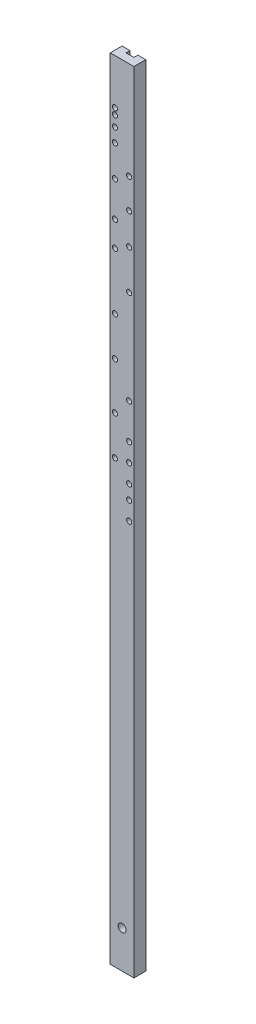
from build123d import *

# Parameters (mm, degrees)
SKETCH1_W           = 19.05
SKETCH1_H           = 1270
BOSS_EXTRUDE1_DEPTH = 19.05
SKETCH2_R           = 6.35
CUT_EXTRUDE1_DEPTH  = 636.571243056
SKETCH4_W           = 12.7
SKETCH4_H           = 12.7
CUT_EXTRUDE2_DEPTH  = 1271.178581194
SKETCH5_R           = 1.905
CUT_EXTRUDE3_DEPTH  = 636.571243056
SKETCH6_R           = 4.1275
CUT_EXTRUDE4_DEPTH  = 7.747


with BuildPart() as part:
    # Sketch1 → Boss-Extrude1 (new, symmetric)
    with BuildSketch(Plane(origin=(0, 0, 0), x_dir=(0, 0, -1), z_dir=(1, 0, 0))):
        Rectangle(SKETCH1_W, SKETCH1_H)
    extrude(amount=BOSS_EXTRUDE1_DEPTH, both=True)

    # Sketch2 → Cut-Extrude1 (cut, through all)
    with BuildSketch(Plane.XY.offset(9.525)):
        with Locations((0, -574.675)):
            Circle(SKETCH2_R)
    extrude(amount=-CUT_EXTRUDE1_DEPTH, mode=Mode.SUBTRACT)

    # Sketch4 → Cut-Extrude2 (cut, through all)
    with BuildSketch(Plane(origin=(0, 635, 0), x_dir=(1, 0, 0), z_dir=(0, 1, 0))):
        with Locations((0, 9.525)):
            Rectangle(SKETCH4_W, SKETCH4_H)
    extrude(amount=-CUT_EXTRUDE2_DEPTH, mode=Mode.SUBTRACT)

    # Sketch5 → Cut-Extrude3 (cut, through all)
    with BuildSketch(Plane.XY.offset(9.525)):
        with Locations((-11.43, 513.302135886)):
            Circle(SKETCH5_R)
        with Locations((11.43, 478.263647874)):
            Circle(SKETCH5_R)
        with Locations((-11.43, 463.345550332)):
            Circle(SKETCH5_R)
        with Locations((11.43, 430.113859098)):
            Circle(SKETCH5_R)
        with Locations((-11.43, 407.064148942)):
            Circle(SKETCH5_R)
        with Locations((11.43, 379.842698104)):
            Circle(SKETCH5_R)
        with Locations((-11.43, 366.551491472)):
            Circle(SKETCH5_R)
        with Locations((11.43, 316.418969048)):
            Circle(SKETCH5_R)
        with Locations((-11.43, 535.422112699)):
            Circle(SKETCH5_R)
        with Locations((-11.43, 552.28498253)):
            Circle(SKETCH5_R)
        with Locations((-11.43, 562.430692594)):
            Circle(SKETCH5_R)
        with Locations((11.43, 165.149796436)):
            Circle(SKETCH5_R)
        with Locations((11.43, 108.45633512)):
            Circle(SKETCH5_R)
        with Locations((11.43, 79.058526758)):
            Circle(SKETCH5_R)
        with Locations((11.43, 49.653866377)):
            Circle(SKETCH5_R)
        with Locations((11.43, 27.043187605)):
            Circle(SKETCH5_R)
        with Locations((11.43, -2.198894726)):
            Circle(SKETCH5_R)
        with Locations((-11.43, 74.386924519)):
            Circle(SKETCH5_R)
        with Locations((-11.43, 137.013245544)):
            Circle(SKETCH5_R)
        with Locations((-11.43, 212.596714918)):
            Circle(SKETCH5_R)
        with Locations((-11.43, 275.179690854)):
            Circle(SKETCH5_R)
    extrude(amount=-CUT_EXTRUDE3_DEPTH, mode=Mode.SUBTRACT)

    # Sketch6 → Cut-Extrude4 (cut)
    with BuildSketch(Plane.XY.offset(9.525)):
        with Locations((-11.43, 513.302135886)):
            Circle(SKETCH6_R)
        with Locations((11.43, 478.263647874)):
            Circle(SKETCH6_R)
        with Locations((-11.43, 463.345550332)):
            Circle(SKETCH6_R)
        with Locations((11.43, 430.113859098)):
            Circle(SKETCH6_R)
        with Locations((11.43, 379.842698104)):
            Circle(SKETCH6_R)
        with Locations((11.43, 316.418969048)):
            Circle(SKETCH6_R)
        with Locations((-11.43, 366.551491472)):
            Circle(SKETCH6_R)
        with Locations((-11.43, 407.064148942)):
            Circle(SKETCH6_R)
        with Locations((-11.43, 562.430692594)):
            Circle(SKETCH6_R)
        with Locations((-11.43, 552.28498253)):
            Circle(SKETCH6_R)
        with Locations((-11.43, 535.422112699)):
            Circle(SKETCH6_R)
        with Locations((-11.43, 275.179690854)):
            Circle(SKETCH6_R)
        with Locations((-11.43, 212.596714918)):
            Circle(SKETCH6_R)
        with Locations((11.43, 165.149796436)):
            Circle(SKETCH6_R)
        with Locations((-11.43, 137.013245544)):
            Circle(SKETCH6_R)
        with Locations((11.43, 108.45633512)):
            Circle(SKETCH6_R)
        with Locations((11.43, 79.058526758)):
            Circle(SKETCH6_R)
        with Locations((-11.43, 74.386924519)):
            Circle(SKETCH6_R)
        with Locations((11.43, 49.653866377)):
            Circle(SKETCH6_R)
        with Locations((11.43, 27.043187605)):
            Circle(SKETCH6_R)
        with Locations((11.43, -2.198894726)):
            Circle(SKETCH6_R)
    extrude(amount=-CUT_EXTRUDE4_DEPTH, mode=Mode.SUBTRACT)


solid = part.part
